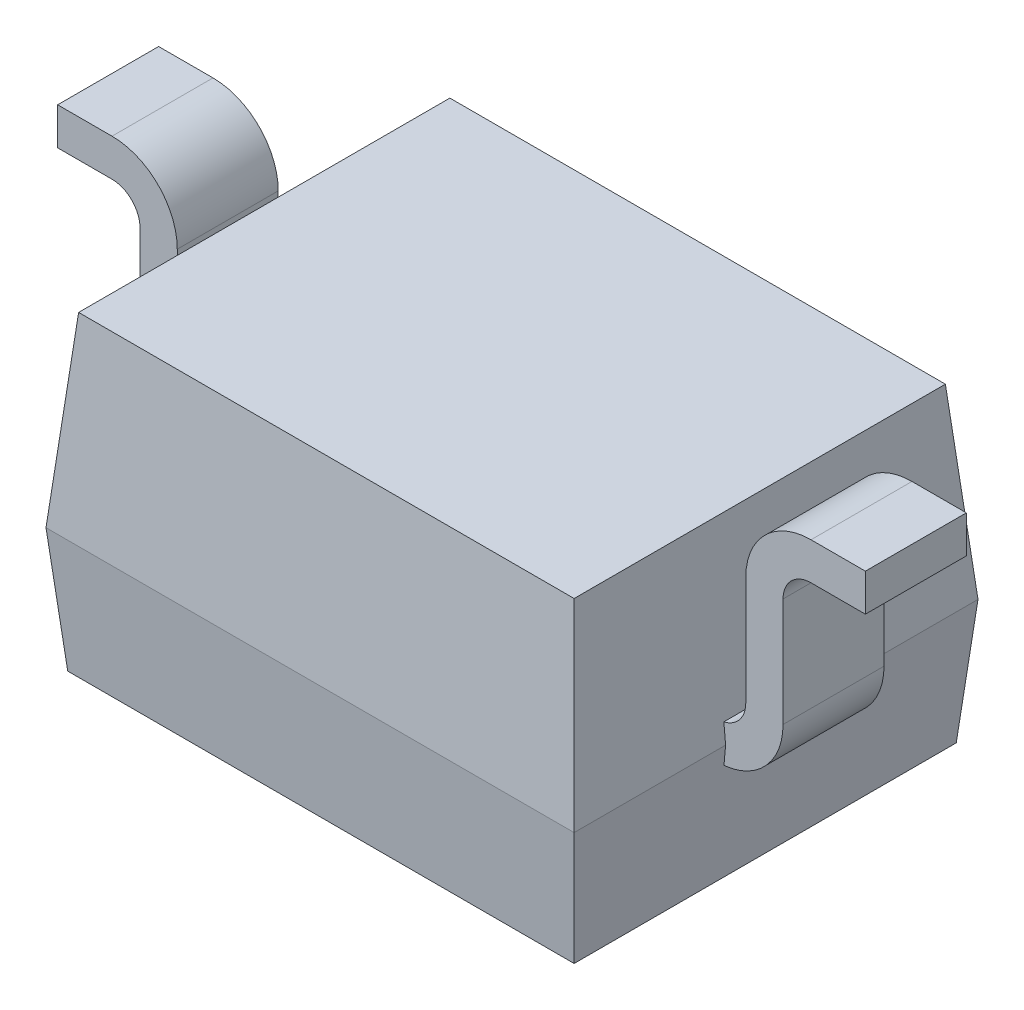
from build123d import *

# Parameters (mm, degrees)
SKETCH2_W                     = 1.7
SKETCH2_H                     = 1.3
BOSS_EXTRUDE1_DEPTH           = 0.6
BOSS_EXTRUDE1_TAPER           = 5
BOSS_EXTRUDE1_OTHER_WAY_DEPTH = 0.4
BOSS_EXTRUDE1_OTHER_WAY_TAPER = 5
EXTRUDE_THIN6_DEPTH           = 0.1625
EXTRUDE_THIN6_2_DEPTH         = 0.1625
SKETCH5_R                     = 0.154965455
SKETCH5_R_2                   = 0.014965455
SKETCH5_W                     = 0.14
SKETCH5_H                     = 1.23000907
CUT_EXTRUDE_THIN1_DEPTH       = 0.01
CUT_EXTRUDE1_START            = 0.01
SKETCH6_R                     = 0.154965455
CUT_EXTRUDE1_DEPTH            = 0.01
CUT_EXTRUDE2_DEPTH            = 0.01


with BuildPart() as part:
    # Sketch2 → Boss-Extrude1 (new body)
    with BuildSketch(Plane(origin=(0, 0, 0), x_dir=(1, 0, 0), z_dir=(0, 1, 0))):
        Rectangle(SKETCH2_W, SKETCH2_H)
    extrude(amount=BOSS_EXTRUDE1_DEPTH, taper=BOSS_EXTRUDE1_TAPER)

    # Sketch2 → Boss-Extrude1 other way (add)
    with BuildSketch(Plane(origin=(0, 0, 0), x_dir=(1, 0, 0), z_dir=(0, 1, 0))):
        Rectangle(SKETCH2_W, SKETCH2_H)
    extrude(amount=-BOSS_EXTRUDE1_OTHER_WAY_DEPTH, taper=BOSS_EXTRUDE1_OTHER_WAY_TAPER)

    # Sketch5 → Cut-Extrude-Thin1 (cut)
    # profile 1 of 2: a face of its own
    with BuildSketch(Plane.XZ.offset(0.4)):
        with Locations((0.574621923, 0.395548424)):
            Circle(SKETCH5_R)
        with Locations((0.574621923, 0.395548424)):
            Circle(SKETCH5_R_2, mode=Mode.SUBTRACT)
    # profile 2 of 2: a face of its own
    with BuildSketch(Plane.XZ.offset(0.4)):
        with Locations((-0.506619328, 0)):
            Rectangle(SKETCH5_W, SKETCH5_H)
    extrude(amount=-CUT_EXTRUDE_THIN1_DEPTH, mode=Mode.SUBTRACT)

    # Sketch6 → Cut-Extrude1 (cut)
    with BuildSketch(Plane.XZ.offset(0.39).offset(CUT_EXTRUDE1_START)):
        with Locations((0.574621923, 0.395548424)):
            Circle(SKETCH6_R)
    extrude(amount=-CUT_EXTRUDE1_DEPTH, mode=Mode.SUBTRACT)

    # Sketch7 → Cut-Extrude2 (cut)
    # profile 1 of 2: a face of its own
    with BuildSketch(Plane.XZ.offset(0.4)):
        with BuildLine():
            add(Edge.make_bspline(
                [(0.135770796, 0.216473748), (0.139457272, 0.215079931), (0.146483353, 0.212423445), (0.155620509, 0.206309111), (0.162195426, 0.198017774), (0.16460564, 0.191606468), (0.16583032, 0.188348748)],
                knots=[0, 0, 0, 0, 1.099088096, 2.094759837, 3.031906972, 4, 4, 4, 4], degree=3))
            add(Edge.make_bspline(
                [(0.16583032, 0.188348748), (0.165630292, 0.185394271), (0.165228908, 0.179465714), (0.161878213, 0.170869074), (0.156329822, 0.162836578), (0.151442353, 0.15820231), (0.148866035, 0.155759462)],
                knots=[0, 0, 0, 0, 0.933029919, 1.872250689, 2.878405478, 4, 4, 4, 4], degree=3))
            Line((0.148866035, 0.155759462), (0.133241035, 0.150997557))
            Line((0.133241035, 0.150997557), (-0.076729204, 0.150997557))
            Line((-0.076729204, 0.150997557), (-0.076729204, -0.555103633))
            add(Edge.make_bspline(
                [(-0.076729204, -0.555103633), (-0.077802922, -0.558071681), (-0.079975895, -0.564078366), (-0.086528911, -0.571673619), (-0.095208321, -0.578075398), (-0.102189792, -0.580858422), (-0.10589587, -0.582335776)],
                knots=[0, 0, 0, 0, 0.906362302, 1.834280943, 2.850339336, 4, 4, 4, 4], degree=3))
            Line((-0.10589587, -0.582335776), (-0.120181584, -0.582335776))
            add(Edge.make_bspline(
                [(-0.120181584, -0.582335776), (-0.122425391, -0.582274188), (-0.126768823, -0.582154969), (-0.132970545, -0.580535899), (-0.138715826, -0.578269093), (-0.143594023, -0.574713989), (-0.147911363, -0.57068195), (-0.150703778, -0.565546173), (-0.152638167, -0.559904422), (-0.152823336, -0.555865706), (-0.15291968, -0.553764347)],
                knots=[0, 0, 0, 0, 1.101604685, 2.132423317, 3.139528337, 4.122044172, 5.089259853, 6.019369827, 6.969470802, 8, 8, 8, 8], degree=3))
            Line((-0.15291968, -0.553764347), (-0.15291968, 0.150997557))
            Line((-0.15291968, 0.150997557), (-0.373455394, 0.150997557))
            add(Edge.make_bspline(
                [(-0.373455394, 0.150997557), (-0.375605965, 0.151315713), (-0.379701686, 0.151921636), (-0.385334498, 0.154031045), (-0.390031559, 0.157050159), (-0.393904776, 0.160900493), (-0.396844862, 0.165606462), (-0.399190144, 0.171046313), (-0.400262586, 0.177445676), (-0.400443144, 0.181947636), (-0.400538727, 0.184330891)],
                knots=[0, 0, 0, 0, 1.08569211, 2.067680532, 2.983433341, 3.861048676, 4.776801484, 5.744887181, 6.80618505, 8, 8, 8, 8], degree=3))
            add(Edge.make_bspline(
                [(-0.400538727, 0.184330891), (-0.40048955, 0.186577458), (-0.400394084, 0.190938592), (-0.398635178, 0.196981969), (-0.396287133, 0.202507185), (-0.39142343, 0.208508397), (-0.383825939, 0.214605167), (-0.376487568, 0.216652307), (-0.372860156, 0.217664224)],
                knots=[0, 0, 0, 0, 0.852234277, 1.654394119, 2.381606146, 3.12243938, 4.577599788, 6, 6, 6, 6], degree=3))
            Line((-0.372860156, 0.217664224), (0.135770796, 0.216473748))
        make_face()
    # profile 2 of 2: a face of its own
    with BuildSketch(Plane.XZ.offset(0.4)):
        with BuildLine():
            Line((0.463270796, 0.199807081), (0.468032701, 0.188646367))
            Line((0.468032701, 0.188646367), (0.468032701, -0.277573871))
            Line((0.468032701, -0.277573871), (0.607616035, -0.277722681))
            add(Edge.make_bspline(
                [(0.607616035, -0.277722681), (0.612156432, -0.278680776), (0.620451495, -0.280431165), (0.631096055, -0.28619262), (0.638516347, -0.294654989), (0.640036016, -0.301606394), (0.640800558, -0.305103633)],
                knots=[0, 0, 0, 0, 1.195577152, 2.184255469, 3.086502086, 4, 4, 4, 4], degree=3))
            add(Edge.make_bspline(
                [(0.640800558, -0.305103633), (0.640657056, -0.308449604), (0.640381324, -0.314878704), (0.637466795, -0.323962047), (0.632438379, -0.331845491), (0.627723941, -0.335819183), (0.625324368, -0.337841728)],
                knots=[0, 0, 0, 0, 1.063672196, 2.043787557, 3.004319249, 4, 4, 4, 4], degree=3))
            Line((0.625324368, -0.337841728), (0.609550558, -0.344240538))
            Line((0.609550558, -0.344240538), (0.468032701, -0.344240538))
            Line((0.468032701, -0.344240538), (0.468032701, -0.555847681))
            add(Edge.make_bspline(
                [(0.468032701, -0.555847681), (0.46704396, -0.558282303), (0.465145145, -0.562957839), (0.46064499, -0.569013593), (0.45487957, -0.573756805), (0.446098316, -0.577590564), (0.436177698, -0.580726058), (0.428415022, -0.581861812), (0.425175558, -0.582335776)],
                knots=[0, 0, 0, 0, 0.881479644, 1.692825178, 2.511522639, 3.362763725, 4.899447501, 6, 6, 6, 6], degree=3))
            add(Edge.make_bspline(
                [(0.425175558, -0.582335776), (0.422592141, -0.582254923), (0.41768393, -0.582101311), (0.410811436, -0.5808446), (0.405028301, -0.57851237), (0.400026105, -0.575642604), (0.396464478, -0.571381888), (0.393583064, -0.566513999), (0.39224088, -0.560575141), (0.39197916, -0.556396882), (0.391842225, -0.554210776)],
                knots=[0, 0, 0, 0, 1.244483934, 2.364384402, 3.340480475, 4.242091871, 5.105208837, 5.982430491, 6.944388035, 8, 8, 8, 8], degree=3))
            Line((0.391842225, -0.554210776), (0.391842225, -0.344240538))
            Line((0.391842225, -0.344240538), (0.066395796, -0.344240538))
            add(Edge.make_bspline(
                [(0.066395796, -0.344240538), (0.063197263, -0.343542243), (0.057033327, -0.34219655), (0.049070771, -0.336962296), (0.042975047, -0.329474285), (0.040769489, -0.32335182), (0.039610082, -0.320133395)],
                knots=[0, 0, 0, 0, 1.02115313, 1.96787762, 2.931764676, 4, 4, 4, 4], degree=3))
            Line((0.039610082, -0.320133395), (0.039461273, -0.31224649))
            add(Edge.make_bspline(
                [(0.039461273, -0.31224649), (0.039788172, -0.308439955), (0.040451907, -0.300711194), (0.044434312, -0.294049709), (0.04645532, -0.290669109)],
                knots=[0, 0, 0, 0, 0.985031118, 2, 2, 2, 2], degree=3))
            Line((0.04645532, -0.290669109), (0.086633892, -0.247663157))
            Line((0.086633892, -0.247663157), (0.403300558, 0.208289224))
            add(Edge.make_bspline(
                [(0.403300558, 0.208289224), (0.405288071, 0.209756918), (0.409048303, 0.21253369), (0.415110621, 0.21528326), (0.420831347, 0.217302968), (0.424664013, 0.217546581), (0.426514844, 0.217664224)],
                knots=[0, 0, 0, 0, 1.161393316, 2.197273816, 3.129445936, 4, 4, 4, 4], degree=3))
            add(Edge.make_bspline(
                [(0.426514844, 0.217664224), (0.427909924, 0.217552731), (0.430879433, 0.21731541), (0.433764793, 0.216570878), (0.435294606, 0.216176129)],
                knots=[0, 0, 0, 0, 0.939603003, 2, 2, 2, 2], degree=3))
            add(Edge.make_bspline(
                [(0.435294606, 0.216176129), (0.438905124, 0.215404381), (0.445434978, 0.214008626), (0.45386256, 0.210465298), (0.460230174, 0.205922753), (0.462307765, 0.201744047), (0.463270796, 0.199807081)],
                knots=[0, 0, 0, 0, 1.307248616, 2.364243258, 3.241773542, 4, 4, 4, 4], degree=3))
        make_face()
        Polygon((0.13395532, -0.277573871), (0.391842225, -0.277573871), (0.391842225, 0.105461843), align=None, mode=Mode.SUBTRACT)
    extrude(amount=-CUT_EXTRUDE2_DEPTH, mode=Mode.SUBTRACT)


with BuildPart() as body_2:
    # Sketch4 → Extrude-Thin6 (new, symmetric)
    with BuildSketch(Plane.XY):
        with BuildLine():
            ThreePointArc((-0.825, 0.06), (-0.88863961, 0.08636039), (-0.915, 0.15))
            Line((-0.915, 0.15), (-0.915, 0.5))
            ThreePointArc((-0.915, 0.5), (-0.976507576, 0.648492424), (-1.125, 0.71))
            Line((-1.125, 0.71), (-1.3, 0.71))
            Line((-1.3, 0.71), (-1.3, 0.59))
            Line((-1.3, 0.59), (-1.125, 0.59))
            ThreePointArc((-1.125, 0.59), (-1.06136039, 0.56363961), (-1.035, 0.5))
            Line((-1.035, 0.5), (-1.035, 0.15))
            ThreePointArc((-1.035, 0.15), (-0.973492424, 0.001507576), (-0.825, -0.06))
            Line((-0.825, -0.06), (-0.825, 0.06))
        make_face()
    extrude(amount=EXTRUDE_THIN6_DEPTH, both=True)


with BuildPart() as body_3:
    # Sketch4 → Extrude-Thin6 2 (new, symmetric)
    with BuildSketch(Plane.XY):
        with BuildLine():
            ThreePointArc((0.825, -0.06), (0.973492424, 0.001507576), (1.035, 0.15))
            Line((1.035, 0.15), (1.035, 0.5))
            ThreePointArc((1.035, 0.5), (1.06136039, 0.56363961), (1.125, 0.59))
            Line((1.125, 0.59), (1.3, 0.59))
            Line((1.3, 0.59), (1.3, 0.71))
            Line((1.3, 0.71), (1.125, 0.71))
            ThreePointArc((1.125, 0.71), (0.976507576, 0.648492424), (0.915, 0.5))
            Line((0.915, 0.5), (0.915, 0.15))
            ThreePointArc((0.915, 0.15), (0.88863961, 0.08636039), (0.825, 0.06))
            Line((0.825, 0.06), (0.825, -0.06))
        make_face()
    extrude(amount=EXTRUDE_THIN6_2_DEPTH, both=True)


solid = Compound([part.part, body_2.part, body_3.part])
